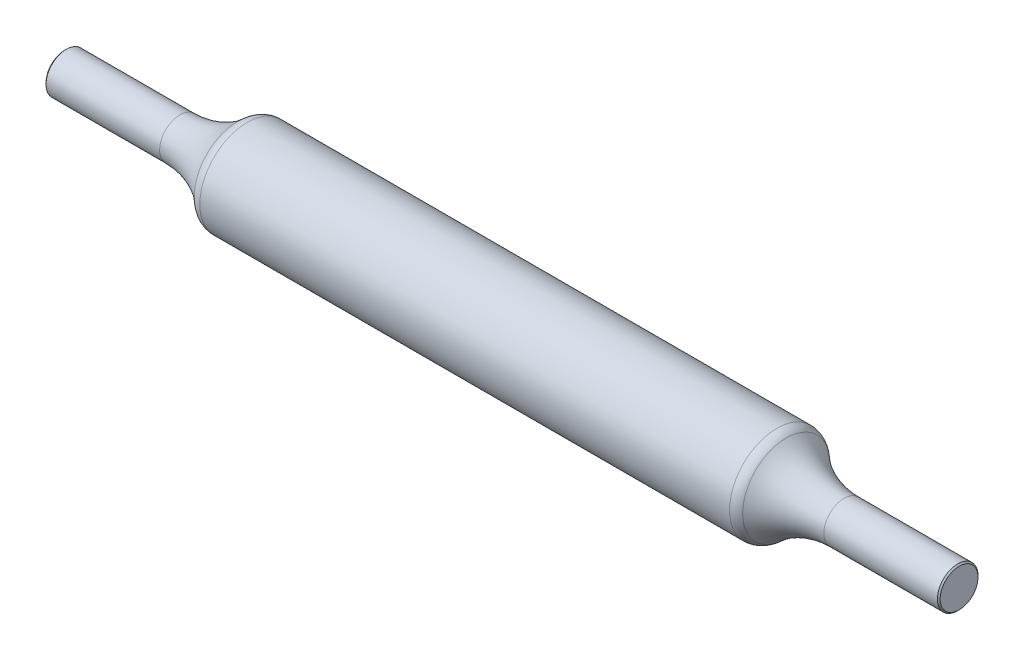
from build123d import *

# Parameters (mm, degrees)
FILLET1_R     = 0.5
CHAMFER1_SIZE = 0.05


with BuildPart() as part:
    # Sketch1 → Revolve1 (revolve)
    with BuildSketch(Plane.XY, mode=Mode.PRIVATE) as revolve1_sk:
        with BuildLine():
            Line((-16.525, 0), (16.525, 0))
            Line((16.525, 0), (16.525, 0.75))
            Line((16.525, 0.75), (12.275, 0.75))
            ThreePointArc((12.275, 0.75), (11.032459759, 1.011033452), (10, 1.75))
            Line((10, 1.75), (-10, 1.75))
            ThreePointArc((-10, 1.75), (-11.032459759, 1.011033452), (-12.275, 0.75))
            Line((-12.275, 0.75), (-16.525, 0.75))
            Line((-16.525, 0.75), (-16.525, 0))
        make_face()
    revolve(revolve1_sk.sketch.rotate(Axis((-16.525, 0, 0), (1, 0, 0)), 180), axis=Axis((-16.525, 0, 0), (1, 0, 0)))

    # Fillet1
    fillet1_edges = [part.edges().sort_by_distance(p)[0] for p in [
        (-10, 1.75, 0),
        (10, 1.75, 0),
    ]]
    fillet(fillet1_edges, radius=FILLET1_R)

    # Chamfer1
    chamfer1_edges = [part.edges().sort_by_distance(p)[0] for p in [
        (-16.525, 0.75, 0),
        (16.525, 0.75, 0),
    ]]
    chamfer(chamfer1_edges, length=CHAMFER1_SIZE)


solid = part.part
